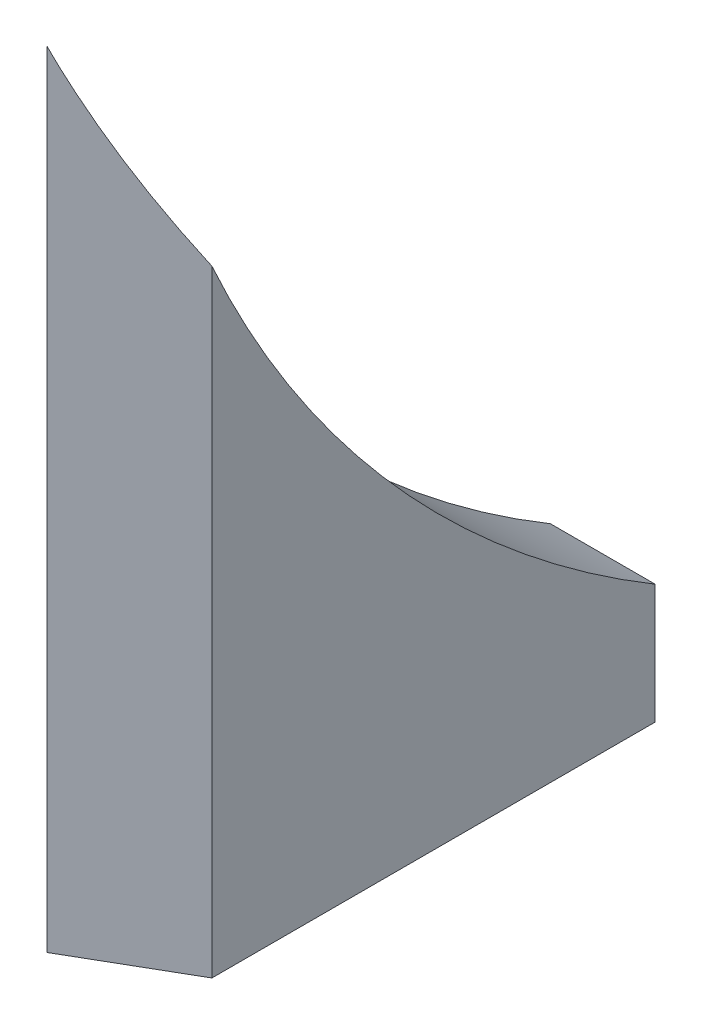
from build123d import *

# Parameters (mm, degrees)
BOSS_EXTRUDE1_DEPTH = 4
SKETCH2_W           = 10.75
SKETCH2_H           = 20.327264221
CUT_EXTRUDE1_DEPTH  = 4
CUT_EXTRUDE2_DEPTH  = 50.8


with BuildPart() as part:
    # Sketch1 → Boss-Extrude1 (new body)
    with BuildSketch(Plane(origin=(0, 0, 0), x_dir=(0, 0, -1), z_dir=(1, 0, 0))):
        with BuildLine():
            Line((-11.867139326, 22.331980986), (-11.867139326, -7.668019014))
            Line((-11.867139326, -7.668019014), (18.132860674, -7.668019014))
            ThreePointArc((18.132860674, -7.668019014), (-0.870157122, 3.328963189), (-11.867139326, 22.331980986))
        make_face()
    extrude(amount=BOSS_EXTRUDE1_DEPTH)

    # Sketch2 → Cut-Extrude1 (cut)
    with BuildSketch(Plane(origin=(4, 0, 0), x_dir=(0, 0, -1), z_dir=(1, 0, 0))):
        with Locations((12.757860674, 2.495613097)):
            Rectangle(SKETCH2_W, SKETCH2_H)
    extrude(amount=-CUT_EXTRUDE1_DEPTH, mode=Mode.SUBTRACT)

    # Sketch3 → Cut-Extrude2 (cut)
    with BuildSketch(Plane.XZ.offset(7.668019014)):
        Polygon((0, 11.867139326), (4, 9.557738249), (4, 11.867139326), align=None)
    extrude(amount=-CUT_EXTRUDE2_DEPTH, mode=Mode.SUBTRACT)


solid = part.part
